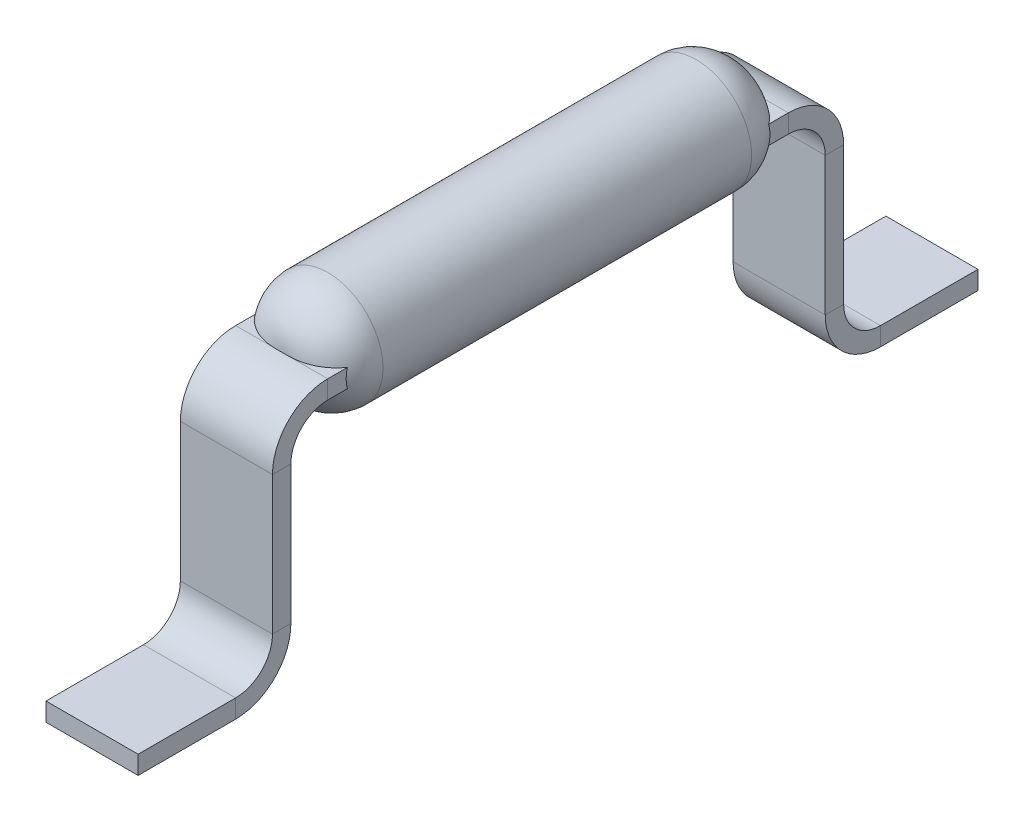
from build123d import *

# Parameters (mm, degrees)
SKETCH2_W = 10
SKETCH2_H = 2


with BuildPart() as part:
    # Sweep1: sweep along a path in Sketch1
    with BuildLine(Plane(origin=(0, 0, 0), x_dir=(0, 0, -1), z_dir=(1, 0, 0))) as sweep1_path:
        Line((-45.581395349, 0), (-35, 0))
        ThreePointArc((-35, 0), (-31.464466094, 1.464466094), (-30, 5))
        Line((-30, 5), (-30, 20))
        ThreePointArc((-30, 20), (-28.535533906, 23.535533906), (-25, 25))
        Line((-25, 25), (25, 25))
        ThreePointArc((25, 25), (28.535533906, 23.535533906), (30, 20))
        Line((30, 20), (30, 5))
        ThreePointArc((30, 5), (31.464466094, 1.464466094), (35, 0))
        Line((35, 0), (45.581395349, 0))
    # Sketch2 → Sweep1 (sweep)
    with BuildSketch(Plane.XY.offset(45.581395349)):
        Rectangle(SKETCH2_W, SKETCH2_H)
    sweep(path=sweep1_path.line)

    # Sketch3 → Revolve1 (revolve)
    with BuildSketch(Plane(origin=(0, 0, 0), x_dir=(0, 0, -1), z_dir=(1, 0, 0)), mode=Mode.PRIVATE) as revolve1_sk:
        with BuildLine():
            Line((-25, 25), (-25, 26))
            ThreePointArc((-25, 26), (-23.535533906, 29.535533906), (-20, 31))
            Line((-20, 31), (20, 31))
            ThreePointArc((20, 31), (23.535533906, 29.535533906), (25, 26))
            Line((25, 26), (25, 25))
            Line((25, 25), (-25, 25))
        make_face()
    revolve(revolve1_sk.sketch.rotate(Axis((0, 25, -25), (0, 0, 1)), 90), axis=Axis((0, 25, -25), (0, 0, 1)))


solid = part.part
